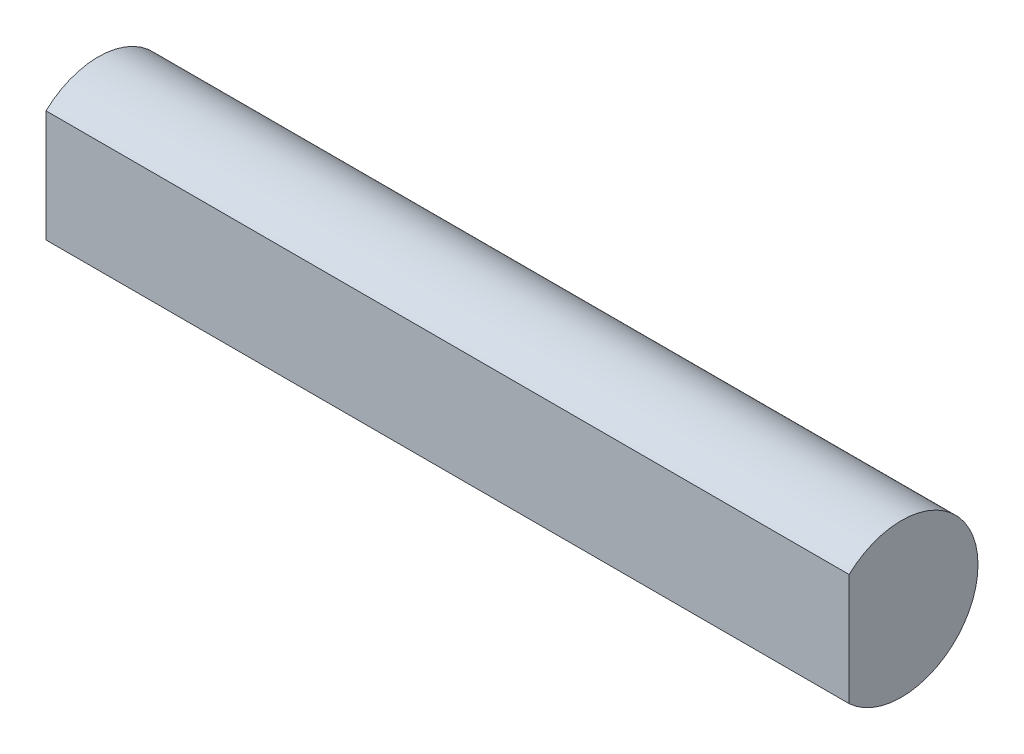
from build123d import *

# Parameters (mm, degrees)
SALIENTE_EXTRUIR1_DEPTH = 43


with BuildPart() as part:
    # Croquis1 → Saliente-Extruir1 (new body)
    with BuildSketch(Plane(origin=(0, 0, 0), x_dir=(0, 0, -1), z_dir=(1, 0, 0))):
        with BuildLine():
            Line((-2.8, 0), (0, 0))
            Line((0, 0), (4.1, 0))
            ThreePointArc((4.1, 0), (1.632482772, 3.760983914), (-2.8, 2.994995826))
            Line((-2.8, 2.994995826), (-2.8, 0))
        make_face()
        with BuildLine():
            Line((4.1, 0), (0, 0))
            Line((0, 0), (-2.8, 0))
            Line((-2.8, 0), (-2.8, -2.994995826))
            ThreePointArc((-2.8, -2.994995826), (1.632482772, -3.760983914), (4.1, 0))
        make_face()
    extrude(amount=SALIENTE_EXTRUIR1_DEPTH)


solid = part.part
